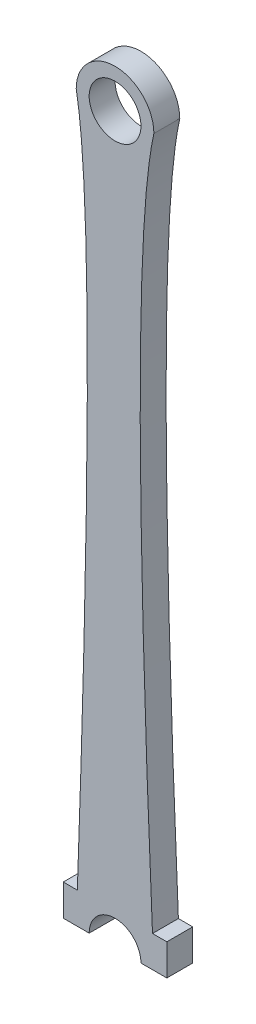
from build123d import *

# Parameters (mm, degrees)
SKETCH1_R           = 10
BOSS_EXTRUDE1_DEPTH = 10


with BuildPart() as part:
    # Sketch1 → Boss-Extrude1 (new body)
    with BuildSketch(Plane.XY):
        with BuildLine():
            Line((-15, -75.267843328), (-10, -75.267843328))
            ThreePointArc((-10, -75.267843328), (0, -65.267843328), (10, -75.267843328))
            Line((10, -75.267843328), (15, -75.267843328))
            Line((15, -75.267843328), (20, -75.267843328))
            Line((20, -75.267843328), (20, -63.153600369))
            Line((20, -63.153600369), (14.459340055, -63.153600369))
            add(Edge.make_bspline(
                [(15, 204.732156672), (8.134301698, 174.35100944), (7.954081716, 85.055757093), (14.459340055, -63.153600369)],
                knots=[0, 0, 0, 0, 0.97375067, 0.97375067, 0.97375067, 0.97375067], degree=3))
            ThreePointArc((15, 204.732156672), (0, 219.732156672), (-15, 204.732156672))
            add(Edge.make_bspline(
                [(-15, 204.732156672), (-9.431523273, 174.705672452), (-9.285696116, 85.410420106), (-14.56251853, -63.153600369)],
                knots=[0, 0, 0, 0, 0.97381202, 0.97381202, 0.97381202, 0.97381202], degree=3))
            Line((-14.56251853, -63.153600369), (-20, -63.153600369))
            Line((-20, -63.153600369), (-20, -75.267843328))
            Line((-20, -75.267843328), (-15, -75.267843328))
        make_face()
        with Locations((0, 204.732156672)):
            Circle(SKETCH1_R, mode=Mode.SUBTRACT)
    extrude(amount=BOSS_EXTRUDE1_DEPTH)

    # Sketch7 → Ø4.0 (4) Diameter Hole2 (revolve, cut)
    with BuildSketch(Plane(origin=(-17, -75.267843328, 5), x_dir=(0, 0, -1), z_dir=(1, 0, 0))):
        Polygon((0, 0), (0, 11.201721238), (2, 10), (2, 0), align=None)
    f_4_0_4_diameter_hole2 = revolve(axis=Axis((-17, -81.617843328, 5), (0, 1, 0)), mode=Mode.SUBTRACT)

    # Mirror2: Ø4.0 (4) Diameter Hole2 across plane
    add(f_4_0_4_diameter_hole2.mirror(Plane(origin=(0, 0, 0), x_dir=(0, 0, 1), z_dir=(1, 0, 0))), mode=Mode.SUBTRACT)


solid = part.part
